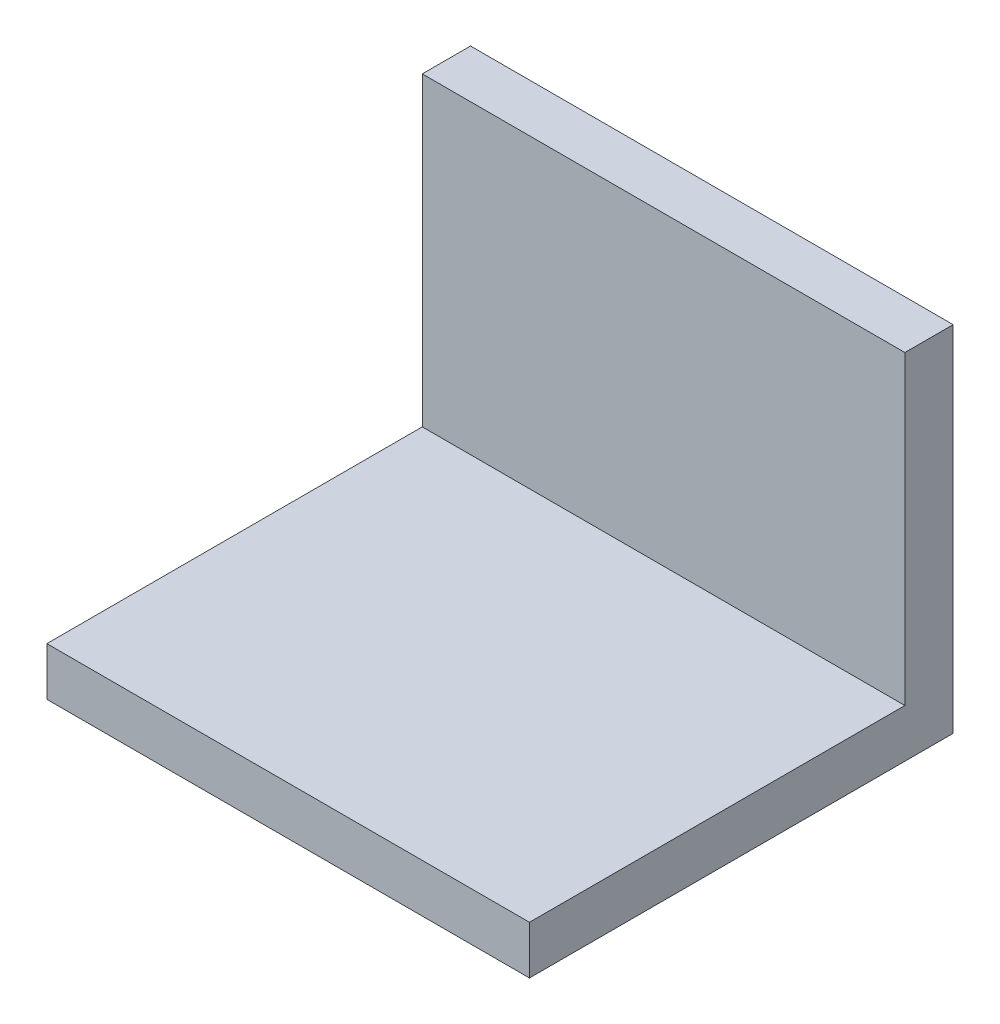
from build123d import *

# Parameters (mm, degrees)
EXTRUDE1_DEPTH = 76.2


with BuildPart() as part:
    # Sketch1 → Extrude1 (new body)
    with BuildSketch(Plane(origin=(0, 0, 0), x_dir=(0, 0, -1), z_dir=(1, 0, 0))):
        Polygon((0, 0), (66.893951326, 0), (66.893951326, 55.885931794), (59.273951326, 55.885931794), (59.273951326, 7.62), (0, 7.62), align=None)
    extrude(amount=-EXTRUDE1_DEPTH)


solid = part.part
